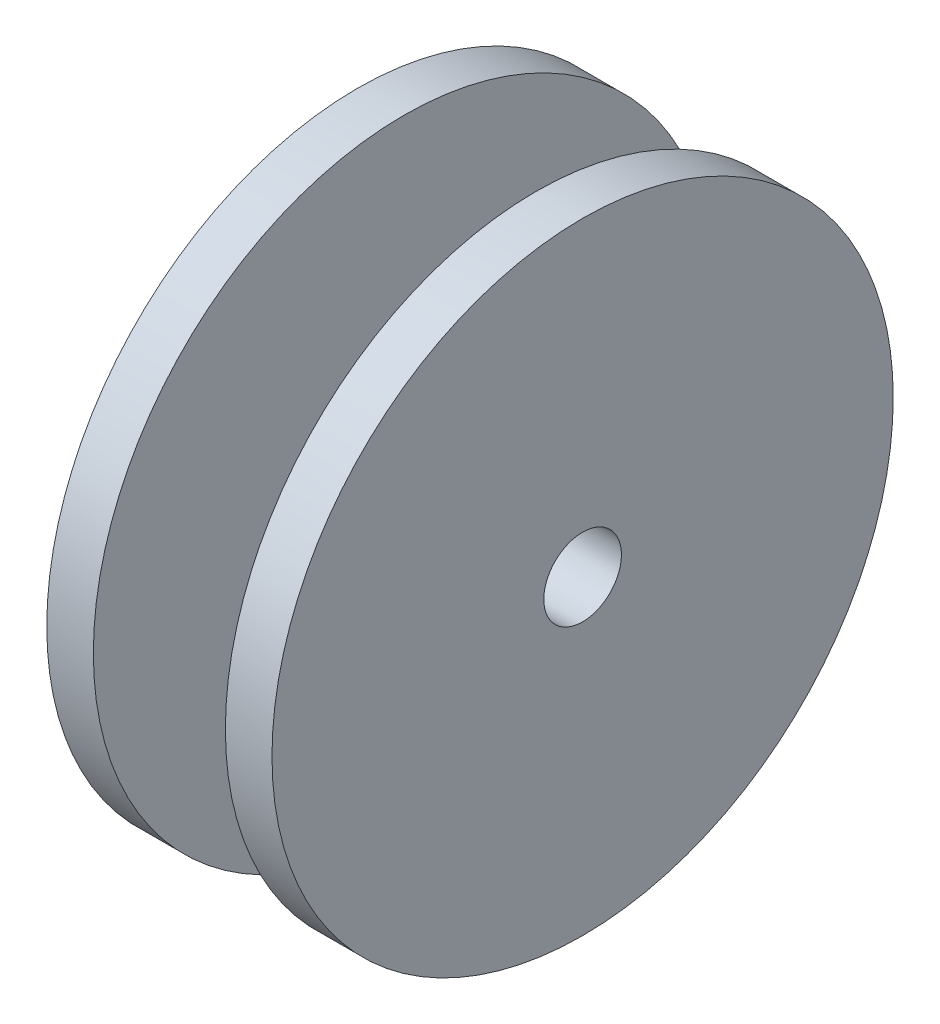
from build123d import *

# Parameters (mm, degrees)
SKETCH1_R               = 20
BOSS_EXTRUDE1_DEPTH     = 7.25
SKETCH2_R               = 20
SKETCH2_R_2             = 7.5
CUT_EXTRUDE1_DEPTH      = 4.25
CUT_EXTRUDE2_DEPTH      = 32.784430151
CUT_EXTRUDE2_DEPTH_BACK = 32.784430151
SKETCH3_R               = 2.5


with BuildPart() as part:
    # Sketch1 → Boss-Extrude1 (new, symmetric)
    with BuildSketch(Plane(origin=(0, 0, 0), x_dir=(0, 0, -1), z_dir=(1, 0, 0))):
        with Locations(Location((0, 0, 0), (0, 0, 180))):
            Circle(SKETCH1_R)
    extrude(amount=BOSS_EXTRUDE1_DEPTH, both=True)

    # Sketch2 → Cut-Extrude1 (cut, symmetric)
    with BuildSketch(Plane(origin=(0, 0, 0), x_dir=(0, 0, -1), z_dir=(1, 0, 0))):
        with Locations(Location((0, 0, 0), (0, 0, 180))):
            Circle(SKETCH2_R)
        Circle(SKETCH2_R_2, mode=Mode.SUBTRACT)
    extrude(amount=CUT_EXTRUDE1_DEPTH, both=True, mode=Mode.SUBTRACT)

    # Sketch3 → Cut-Extrude2 (cut, two sides: drawn at the far end of the back side and taken through both)
    with BuildSketch(Plane(origin=(7.25, 0, 0), x_dir=(0, 0, -1), z_dir=(1, 0, 0)).offset(-CUT_EXTRUDE2_DEPTH_BACK)):
        Circle(SKETCH3_R)
    extrude(amount=CUT_EXTRUDE2_DEPTH + CUT_EXTRUDE2_DEPTH_BACK, mode=Mode.SUBTRACT)


solid = part.part
